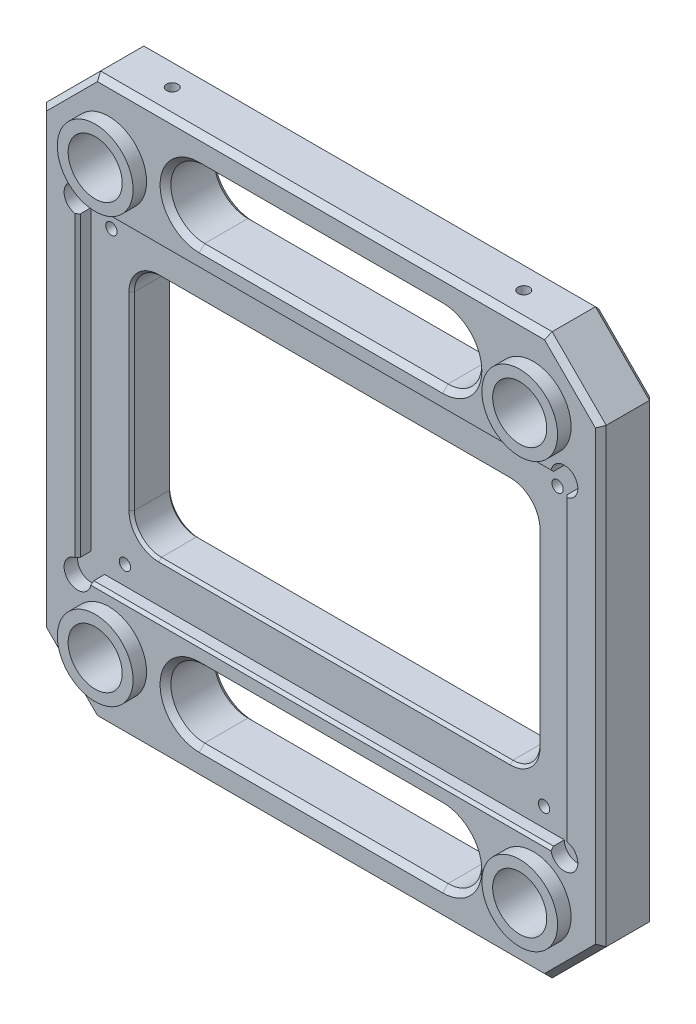
from build123d import *

# Parameters (mm, degrees)
EXTRUDE_1_DEPTH           = 20
SKETCH_4_R                = 13.999999999999998
EXTRUDE_2_DEPTH           = 5
HOLE_WIZARD_1_D           = 13.5
HOLE_WIZARD_1_DEPTH       = 57
HOLE_WIZARD_1_CBORE_D     = 20
HOLE_WIZARD_1_CBORE_DEPTH = 18
HOLE_WIZARD_1_TIP         = 4.055809178436032
CHAMFER_2_SIZE            = 20
CUT_EXTRUDE_1_DEPTH       = 5
SKETCH_10_R               = 5.000000000000005
CUT_EXTRUDE_2_DEPTH       = 5
CUT_EXTRUDE_3_DEPTH       = 148.73117477364084
CHAMFER_1_SIZE            = 2
SKETCH_12_W               = 150
SKETCH_12_H               = 89.99999999999999
CUT_EXTRUDE_4_DEPTH       = 148.1376906166466
FILLET_1_R                = 10
CHAMFER_3_SIZE            = 1
HOLE_WIZARD_M5_1_D        = 4.2
HOLE_WIZARD_M5_1_DEPTH    = 12.4
HOLE_WIZARD_M5_1_TIP      = 1.2618072999578767
HOLE_WIZARD_M5_2_D        = 4.2
HOLE_WIZARD_M5_2_DEPTH    = 12.4
HOLE_WIZARD_M5_2_TIP      = 1.2618072999578767


with BuildPart() as part:
    # 草图1 → 凸台-拉伸1 (new body)
    with BuildSketch(Plane.XY):
        Polygon((-103.49999999999999, 103.50000000000003), (103.50000000000001, 103.50000000000003), (103.50000000000001, -103.49999999999999), (-103.49999999999996, -103.49999999999999), align=None)
    extrude(amount=EXTRUDE_1_DEPTH)

    # 草图4 → 凸台-拉伸2 (add)
    with BuildSketch(Plane.XY.offset(20)):
        with Locations((-78.5, -78.5)):
            Circle(SKETCH_4_R)
        with Locations((-78.5, 78.5)):
            Circle(SKETCH_4_R)
        with Locations((78.5, 78.5)):
            Circle(SKETCH_4_R)
        with Locations((78.5, -78.5)):
            Circle(SKETCH_4_R)
    extrude(amount=EXTRUDE_2_DEPTH)

    # 打孔尺寸(%根据)内六角圆柱头螺钉的类型1
    with Locations(Plane.XY.offset(25)):
        with Locations((-78.5, -78.5), (-78.5, 78.5), (78.5, 78.5), (78.5, -78.5)):
            CounterBoreHole(HOLE_WIZARD_1_D / 2, HOLE_WIZARD_1_CBORE_D / 2, HOLE_WIZARD_1_CBORE_DEPTH, depth=HOLE_WIZARD_1_DEPTH)
            with Locations((0, 0, -(HOLE_WIZARD_1_DEPTH + HOLE_WIZARD_1_TIP / 2))):  # 118° drill point
                Cone(0, HOLE_WIZARD_1_D / 2, HOLE_WIZARD_1_TIP, mode=Mode.SUBTRACT)

    # 倒角2
    chamfer_2_edges = [part.edges().sort_by_distance(p)[0] for p in [
        (103.50000000000001, -103.49999999999999, 10),
        (-103.49999999999996, -103.49999999999999, 10),
        (-103.49999999999999, 103.50000000000003, 10),
        (103.50000000000001, 103.50000000000003, 10),
    ]]
    chamfer(chamfer_2_edges, length=CHAMFER_2_SIZE)

    # 草图9 → 切除-拉伸1 (cut)
    with BuildSketch(Plane.XY.offset(20)):
        Polygon((90, 60.000000000000014), (-90, 59.999999999999986), (-89.99999999999999, -60), (90.00000000000001, -59.999999999999986), align=None)
    extrude(amount=-CUT_EXTRUDE_1_DEPTH, mode=Mode.SUBTRACT)

    # 草图10 → 切除-拉伸2 (cut)
    with BuildSketch(Plane.XY.offset(20)):
        with Locations((90.00000000000001, -59.999999999999986)):
            Circle(SKETCH_10_R)
        with Locations((-89.99999999999999, -60)):
            Circle(SKETCH_10_R)
        with Locations((90, 60.000000000000014)):
            Circle(SKETCH_10_R)
        with Locations((-90, 59.999999999999986)):
            Circle(SKETCH_10_R)
    extrude(amount=-CUT_EXTRUDE_2_DEPTH, mode=Mode.SUBTRACT)

    # 草图11 → 切除-拉伸3 (cut, through all)
    with BuildSketch(Plane.XY.offset(20)):
        with BuildLine():
            Line((45.000000000000036, -92.49999999999997), (-44.99999999999998, -92.5))
            ThreePointArc((-44.99999999999998, -92.5), (-57.499999999999964, -80.00000000000001), (-44.99999999999998, -67.50000000000003))
            Line((-44.99999999999998, -67.50000000000003), (45.00000000000001, -67.5))
            ThreePointArc((45.00000000000001, -67.5), (57.50000000000001, -79.99999999999997), (45.000000000000036, -92.49999999999997))
        make_face()
        with BuildLine():
            Line((45.000000000000014, 67.50000000000004), (-45, 67.50000000000001))
            ThreePointArc((-45, 67.50000000000001), (-57.500000000000014, 80.00000000000001), (-45, 92.50000000000003))
            Line((-45, 92.50000000000003), (44.999999999999986, 92.50000000000006))
            ThreePointArc((44.999999999999986, 92.50000000000006), (57.5, 80.00000000000006), (45.000000000000014, 67.50000000000004))
        make_face()
    extrude(amount=-CUT_EXTRUDE_3_DEPTH, mode=Mode.SUBTRACT)

    # 倒角1
    chamfer_1_edges = [part.edges().sort_by_distance(p)[0] for p in [
        (57.50000000000001, -79.99999999999997, 0),
        (2.487e-14, -92.49999999999999, 0),
        (-57.49999999999997, -80.00000000000001, 0),
        (1.066e-14, -67.50000000000003, 0),
        (57.50000000000001, -79.99999999999997, 20),
        (1.421e-14, -67.50000000000001, 20),
        (-57.49999999999997, -80.00000000000001, 20),
        (2.842e-14, -92.49999999999999, 20),
        (57.50000000000001, 80.00000000000007, 0),
        (7.11e-15, 67.50000000000003, 0),
        (-57.50000000000001, 80.00000000000003, 0),
        (-1.066e-14, 92.50000000000003, 0),
        (57.50000000000001, 80.00000000000007, 20),
        (-7.11e-15, 92.50000000000004, 20),
        (-57.50000000000001, 80.00000000000003, 20),
        (7.11e-15, 67.50000000000003, 20),
        (1.421e-14, 103.50000000000003, 0),
        (1.421e-14, 103.50000000000003, 20),
        (103.50000000000001, 2.842e-14, 0),
        (2.842e-14, -103.49999999999999, 0),
        (-103.49999999999997, 1.421e-14, 0),
        (93.50000000000001, -93.49999999999999, 0),
        (-93.49999999999996, -93.5, 0),
        (-93.49999999999999, 93.50000000000003, 0),
        (93.50000000000001, 93.50000000000004, 0),
        (103.50000000000001, 2.842e-14, 20),
        (-103.49999999999997, 1.421e-14, 20),
        (2.842e-14, -103.49999999999999, 20),
        (93.50000000000001, -93.49999999999999, 20),
        (-93.49999999999996, -93.5, 20),
        (-93.49999999999999, 93.50000000000003, 20),
        (93.50000000000001, 93.50000000000004, 20),
    ]]
    chamfer(chamfer_1_edges, length=CHAMFER_1_SIZE)

    # 草图12 → 切除-拉伸4 (cut, through all)
    with BuildSketch(Plane.XY.offset(15)):
        Rectangle(SKETCH_12_W, SKETCH_12_H)
    extrude(amount=-CUT_EXTRUDE_4_DEPTH, mode=Mode.SUBTRACT)

    # 圆角1
    fillet_1_edges = [part.edges().sort_by_distance(p)[0] for p in [
        (-75, -45, 7.5),
        (-75, 44.999999999999986, 7.5),
        (74.99999999999999, 44.999999999999986, 7.5),
        (74.99999999999999, -45, 7.5),
    ]]
    fillet(fillet_1_edges, radius=FILLET_1_R)

    # 倒角3
    chamfer_3_edges = [part.edges().sort_by_distance(p)[0] for p in [
        (1.421e-14, -59.99999999999999, 20),
        (90, 2.132e-14, 20),
        (0, 60, 20),
        (-90, -7.11e-15, 20),
        (-1.421e-14, 44.999999999999986, 15),
        (-7.11e-15, 44.999999999999986, 0),
        (74.99999999999999, -7.11e-15, 15),
        (74.99999999999999, -7.11e-15, 0),
        (-75, -7.11e-15, 15),
        (-75, -7.11e-15, 0),
        (-1.421e-14, -45, 15),
        (0, -45, 0),
        (72.07106781186546, 42.07106781186546, 15),
        (72.07106781186546, 42.071067811865454, 0),
        (-72.07106781186548, 42.07106781186546, 15),
        (-72.07106781186548, 42.07106781186546, 0),
        (-72.07106781186548, -42.071067811865476, 15),
        (-72.07106781186548, -42.071067811865476, 0),
        (72.07106781186548, -42.071067811865476, 15),
        (72.07106781186548, -42.071067811865476, 0),
    ]]
    chamfer(chamfer_3_edges, length=CHAMFER_3_SIZE)

    # M5 螺纹孔1
    with Locations(Plane.XY.offset(15)):
        with Locations((77.5, -53), (-77.5, -53), (-82.5, 52), (82.5, 52)):
            Hole(HOLE_WIZARD_M5_1_D / 2, depth=HOLE_WIZARD_M5_1_DEPTH)
            with Locations((0, 0, -(HOLE_WIZARD_M5_1_DEPTH + HOLE_WIZARD_M5_1_TIP / 2))):  # 118° drill point
                Cone(0, HOLE_WIZARD_M5_1_D / 2, HOLE_WIZARD_M5_1_TIP, mode=Mode.SUBTRACT)

    # M5 螺纹孔2
    with Locations(Plane(origin=(0, 103.50000000000003, 0), x_dir=(1, 0, 0), z_dir=(0, 1, 0))):
        with Locations((-65, -10), (65, -10)):
            Hole(HOLE_WIZARD_M5_2_D / 2, depth=HOLE_WIZARD_M5_2_DEPTH)
            with Locations((0, 0, -(HOLE_WIZARD_M5_2_DEPTH + HOLE_WIZARD_M5_2_TIP / 2))):  # 118° drill point
                Cone(0, HOLE_WIZARD_M5_2_D / 2, HOLE_WIZARD_M5_2_TIP, mode=Mode.SUBTRACT)


solid = part.part
